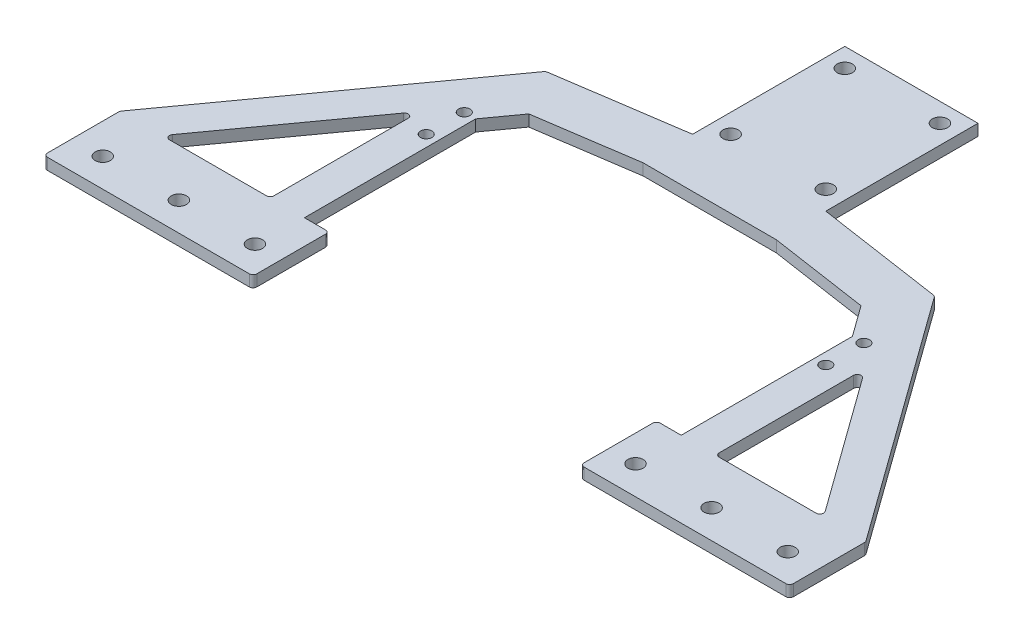
from build123d import *

# Parameters (mm, degrees)
SKETCH_1_R          = 2
EXTRUDE_1_DEPTH     = 4
SKETCH_2_R          = 1.5
SKETCH_2_R_2        = 2
EXTRUDE_2_DEPTH     = 4
CUT_EXTRUDE_1_DEPTH = 174.943237868
FILLET_2_R          = 1
FILLET_3_R          = 1
CUT_EXTRUDE_START   = -12.7
CUT_EXTRUDE_2_DEPTH = 11
SKETCH_5_R          = 2
SKETCH_5_R_2        = 1.5
EXTRUDE_3_DEPTH     = 1.3


with BuildPart() as part:
    # 草图1 → 凸台-拉伸1 (new body)
    with BuildSketch(Plane(origin=(0, 0, 0), x_dir=(1, 0, 0), z_dir=(0, 1, 0))):
        Polygon((0, 0), (0, -110), (-62.5, -110), (-62.5, -130), (97.5, -130), (97.5, -110), (35, -110), (35, 0), align=None)
        with Locations(Location((5, -5, 0), (0, 0, 270))):
            Circle(SKETCH_1_R, mode=Mode.SUBTRACT)
        with Locations(Location((30, -5, 0), (0, 0, 270))):
            Circle(SKETCH_1_R, mode=Mode.SUBTRACT)
        with Locations(Location((5, -35, 0), (0, 0, 270))):
            Circle(SKETCH_1_R, mode=Mode.SUBTRACT)
        with Locations(Location((30, -35, 0), (0, 0, 270))):
            Circle(SKETCH_1_R, mode=Mode.SUBTRACT)
        with Locations(Location((-52.5, -122.5, 0), (0, 0, 270))):
            Circle(SKETCH_1_R, mode=Mode.SUBTRACT)
        with Locations(Location((-32.5, -122.5, 0), (0, 0, 270))):
            Circle(SKETCH_1_R, mode=Mode.SUBTRACT)
        with Locations(Location((-12.5, -122.5, 0), (0, 0, 270))):
            Circle(SKETCH_1_R, mode=Mode.SUBTRACT)
        with Locations(Location((7.5, -122.5, 0), (0, 0, 270))):
            Circle(SKETCH_1_R, mode=Mode.SUBTRACT)
        with Locations(Location((27.5, -122.5, 0), (0, 0, 270))):
            Circle(SKETCH_1_R, mode=Mode.SUBTRACT)
        with Locations(Location((47.5, -122.5, 0), (0, 0, 270))):
            Circle(SKETCH_1_R, mode=Mode.SUBTRACT)
        with Locations(Location((67.5, -122.5, 0), (0, 0, 270))):
            Circle(SKETCH_1_R, mode=Mode.SUBTRACT)
        with Locations(Location((87.5, -122.5, 0), (0, 0, 270))):
            Circle(SKETCH_1_R, mode=Mode.SUBTRACT)
    extrude(amount=EXTRUDE_1_DEPTH)

    # 草图2 → 凸台-拉伸2 (add)
    # profile 1 of 2: a face of its own
    with BuildSketch(Plane(origin=(0, 4, 0), x_dir=(1, 0, 0), z_dir=(0, 1, 0))):
        Polygon((0, -40), (0, -53), (-26.149225941, -56.891259047), (-32, -65), (-32, -110), (-41, -110), (-41, -70.637206461), (-69.401796613, -110), (-62.5, -110), (-62.5, -130), (-80.5, -130), (-80.5, -110), (-33.599955214, -45), align=None)
        with Locations(Location((-35, -65, 0), (0, 0, 270))):
            Circle(SKETCH_2_R, mode=Mode.SUBTRACT)
        with Locations(Location((-35, -75, 0), (0, 0, 270))):
            Circle(SKETCH_2_R, mode=Mode.SUBTRACT)
        with Locations(Location((-72.5, -122.5, 0), (0, 0, 270))):
            Circle(SKETCH_2_R_2, mode=Mode.SUBTRACT)
    # profile 2 of 2: a face of its own
    with BuildSketch(Plane(origin=(0, 4, 0), x_dir=(1, 0, 0), z_dir=(0, 1, 0))):
        Polygon((67, -65), (67, -110), (76, -110), (76, -70.637206461), (104.401796613, -110), (97.5, -110), (97.5, -130), (115.5, -130), (115.5, -110), (68.599955214, -45), (35, -40), (35, -53), (61.149225941, -56.891259047), align=None)
        with Locations(Location((70, -65, 0), (0, 0, 270))):
            Circle(SKETCH_2_R, mode=Mode.SUBTRACT)
        with Locations(Location((70, -75, 0), (0, 0, 270))):
            Circle(SKETCH_2_R, mode=Mode.SUBTRACT)
        with Locations(Location((107.5, -122.5, 0), (0, 0, 270))):
            Circle(SKETCH_2_R_2, mode=Mode.SUBTRACT)
    extrude(amount=-EXTRUDE_2_DEPTH)

    # 草图3 → 切除-拉伸1 (cut, through all)
    with BuildSketch(Plane(origin=(0, 4, 0), x_dir=(1, 0, 0), z_dir=(0, 1, 0))):
        Polygon((0, -53), (35, -53), (35, -110), (60.5, -110), (60.5, -130), (-25.5, -130), (-25.5, -110), (0, -110), align=None)
    extrude(amount=-CUT_EXTRUDE_1_DEPTH, mode=Mode.SUBTRACT)

    # 圆角2
    fillet_2_edges = [part.edges().sort_by_distance(p)[0] for p in [
        (76, 2, 70.637206461),
        (104.401796613, 2, 110),
        (76, 2, 110),
        (-41, 2, 70.637206461),
        (-41, 2, 110),
        (-69.401796613, 2, 110),
    ]]
    fillet(fillet_2_edges, radius=FILLET_2_R)

    # 圆角3
    fillet_3_edges = [part.edges().sort_by_distance(p)[0] for p in [
        (115.5, 2, 130),
        (115.5, 2, 110),
        (68.599955214, 2, 45),
        (60.5, 2, 110),
        (60.5, 2, 130),
        (-25.5, 2, 130),
        (-25.5, 2, 110),
        (-33.599955214, 2, 45),
        (-80.5, 2, 110),
        (-80.5, 2, 130),
    ]]
    fillet(fillet_3_edges, radius=FILLET_3_R)

    # 草图4 → 切除-拉伸2 (cut)
    with BuildSketch(Plane(origin=(0, 4, 0), x_dir=(1, 0, 0), z_dir=(0, 1, 0)).offset(CUT_EXTRUDE_START)):
        with BuildLine():
            Line((0, -40), (-33.182912111, -44.937939932))
            ThreePointArc((-33.182912111, -44.937939932), (-33.555630957, -45.072825937), (-33.846665233, -45.341921875))
            Line((-33.846665233, -45.341921875), (-80.310942068, -109.737979661))
            ThreePointArc((-80.310942068, -109.737979661), (-80.451562417, -110.015650479), (-80.5, -110.323106112))
            Line((-80.5, -110.323106112), (-80.5, -129))
            ThreePointArc((-80.5, -129), (-80.207106781, -129.707106781), (-79.5, -130))
            Line((-79.5, -130), (-26.5, -130))
            ThreePointArc((-26.5, -130), (-25.792893219, -129.707106781), (-25.5, -129))
            Line((-25.5, -129), (-25.5, -111))
            ThreePointArc((-25.5, -111), (-25.792893219, -110.292893219), (-26.5, -110))
            Line((-26.5, -110), (-32, -110))
            Line((-32, -110), (-32, -65))
            Line((-32, -65), (-26.149225941, -56.891259047))
            Line((-26.149225941, -56.891259047), (0, -53))
            Line((0, -53), (35, -53))
            Line((35, -53), (61.149225941, -56.891259047))
            Line((61.149225941, -56.891259047), (67, -65))
            Line((67, -65), (67, -110))
            Line((67, -110), (61.5, -110))
            ThreePointArc((61.5, -110), (60.792893219, -110.292893219), (60.5, -111))
            Line((60.5, -111), (60.5, -129))
            ThreePointArc((60.5, -129), (60.792893219, -129.707106781), (61.5, -130))
            Line((61.5, -130), (114.5, -130))
            ThreePointArc((114.5, -130), (115.207106781, -129.707106781), (115.5, -129))
            Line((115.5, -129), (115.5, -110.323106112))
            ThreePointArc((115.5, -110.323106112), (115.451562417, -110.015650479), (115.310942068, -109.737979661))
            Line((115.310942068, -109.737979661), (68.846665233, -45.341921875))
            ThreePointArc((68.846665233, -45.341921875), (68.555630957, -45.072825937), (68.182912111, -44.937939932))
            Line((68.182912111, -44.937939932), (35, -40))
            Line((35, -40), (35, 0))
            Line((35, 0), (0, 0))
            Line((0, 0), (0, -40))
        make_face()
    extrude(amount=CUT_EXTRUDE_2_DEPTH, mode=Mode.SUBTRACT)

    # 草图5 → 凸台-拉伸3 (add)
    with BuildSketch(Plane(origin=(0, 4, 0), x_dir=(1, 0, 0), z_dir=(0, 1, 0))):
        with BuildLine():
            Line((0, -40), (-33.182912111, -44.937939932))
            ThreePointArc((-33.182912111, -44.937939932), (-33.555630957, -45.072825937), (-33.846665233, -45.341921875))
            Line((-33.846665233, -45.341921875), (-80.310942068, -109.737979661))
            ThreePointArc((-80.310942068, -109.737979661), (-80.451562417, -110.015650479), (-80.5, -110.323106112))
            Line((-80.5, -110.323106112), (-80.5, -129))
            ThreePointArc((-80.5, -129), (-80.207106781, -129.707106781), (-79.5, -130))
            Line((-79.5, -130), (-26.5, -130))
            ThreePointArc((-26.5, -130), (-25.792893219, -129.707106781), (-25.5, -129))
            Line((-25.5, -129), (-25.5, -111))
            ThreePointArc((-25.5, -111), (-25.792893219, -110.292893219), (-26.5, -110))
            Line((-26.5, -110), (-32, -110))
            Line((-32, -110), (-32, -65))
            Line((-32, -65), (-26.149225941, -56.891259047))
            Line((-26.149225941, -56.891259047), (0, -53))
            Line((0, -53), (35, -53))
            Line((35, -53), (61.149225941, -56.891259047))
            Line((61.149225941, -56.891259047), (67, -65))
            Line((67, -65), (67, -110))
            Line((67, -110), (61.5, -110))
            ThreePointArc((61.5, -110), (60.792893219, -110.292893219), (60.5, -111))
            Line((60.5, -111), (60.5, -129))
            ThreePointArc((60.5, -129), (60.792893219, -129.707106781), (61.5, -130))
            Line((61.5, -130), (114.5, -130))
            ThreePointArc((114.5, -130), (115.207106781, -129.707106781), (115.5, -129))
            Line((115.5, -129), (115.5, -110.323106112))
            ThreePointArc((115.5, -110.323106112), (115.451562417, -110.015650479), (115.310942068, -109.737979661))
            Line((115.310942068, -109.737979661), (68.846665233, -45.341921875))
            ThreePointArc((68.846665233, -45.341921875), (68.555630957, -45.072825937), (68.182912111, -44.937939932))
            Line((68.182912111, -44.937939932), (35, -40))
            Line((35, -40), (35, 0))
            Line((35, 0), (0, 0))
            Line((0, 0), (0, -40))
        make_face()
        with Locations(Location((30, -5, 0), (0, 0, 270))):
            Circle(SKETCH_5_R, mode=Mode.SUBTRACT)
        with Locations(Location((30, -35, 0), (0, 0, 270))):
            Circle(SKETCH_5_R, mode=Mode.SUBTRACT)
        with Locations(Location((-32.5, -122.5, 0), (0, 0, 270))):
            Circle(SKETCH_5_R, mode=Mode.SUBTRACT)
        with Locations(Location((87.5, -122.5, 0), (0, 0, 270))):
            Circle(SKETCH_5_R, mode=Mode.SUBTRACT)
        with Locations(Location((-72.5, -122.5, 0), (0, 0, 270))):
            Circle(SKETCH_5_R, mode=Mode.SUBTRACT)
        with Locations(Location((-35, -65, 0), (0, 0, 270))):
            Circle(SKETCH_5_R_2, mode=Mode.SUBTRACT)
        with Locations(Location((-35, -75, 0), (0, 0, 270))):
            Circle(SKETCH_5_R_2, mode=Mode.SUBTRACT)
        with Locations(Location((107.5, -122.5, 0), (0, 0, 270))):
            Circle(SKETCH_5_R, mode=Mode.SUBTRACT)
        with Locations(Location((70, -75, 0), (0, 0, 270))):
            Circle(SKETCH_5_R_2, mode=Mode.SUBTRACT)
        with Locations(Location((70, -65, 0), (0, 0, 270))):
            Circle(SKETCH_5_R_2, mode=Mode.SUBTRACT)
        with Locations(Location((67.5, -122.5, 0), (0, 0, 270))):
            Circle(SKETCH_5_R, mode=Mode.SUBTRACT)
        with Locations(Location((-52.5, -122.5, 0), (0, 0, 270))):
            Circle(SKETCH_5_R, mode=Mode.SUBTRACT)
        with Locations(Location((5, -35, 0), (0, 0, 270))):
            Circle(SKETCH_5_R, mode=Mode.SUBTRACT)
        with Locations(Location((5, -5, 0), (0, 0, 270))):
            Circle(SKETCH_5_R, mode=Mode.SUBTRACT)
        with BuildLine():
            Line((102.447123753, -110), (77, -110))
            ThreePointArc((77, -110), (76.292893219, -109.707106781), (76, -109))
            Line((76, -109), (76, -73.732164937))
            ThreePointArc((76, -73.732164937), (76.692544367, -72.78060252), (77.810942068, -73.147038486))
            Line((77.810942068, -73.147038486), (103.258065821, -108.414873549))
            ThreePointArc((103.258065821, -108.414873549), (103.337383954, -109.455452275), (102.447123753, -110))
        make_face(mode=Mode.SUBTRACT)
        with BuildLine():
            Line((-41, -73.732164937), (-41, -109))
            ThreePointArc((-41, -109), (-41.292893219, -109.707106781), (-42, -110))
            Line((-42, -110), (-67.447123753, -110))
            ThreePointArc((-67.447123753, -110), (-68.337383954, -109.455452275), (-68.258065821, -108.414873549))
            Line((-68.258065821, -108.414873549), (-42.810942068, -73.147038486))
            ThreePointArc((-42.810942068, -73.147038486), (-41.692544367, -72.78060252), (-41, -73.732164937))
        make_face(mode=Mode.SUBTRACT)
    extrude(amount=EXTRUDE_3_DEPTH)


solid = part.part
